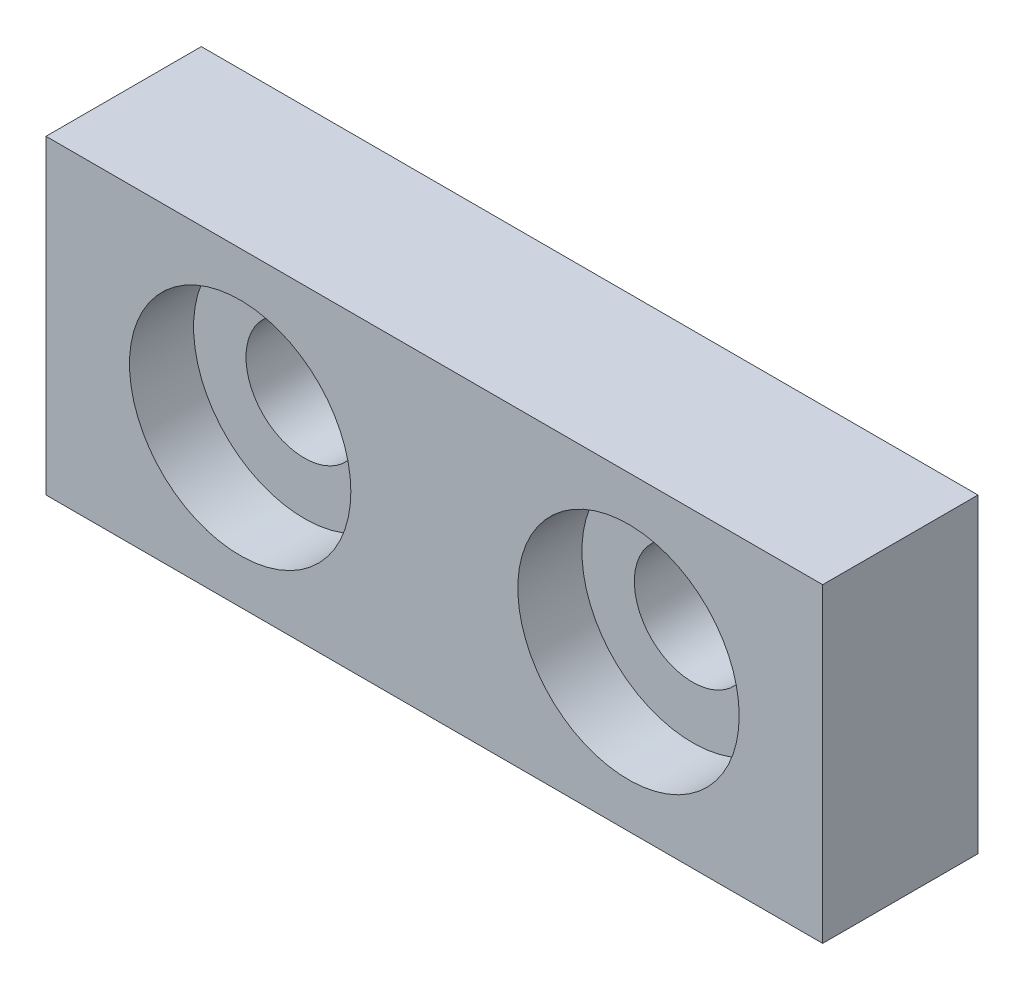
from build123d import *

# Parameters (mm, degrees)
CROQUIS1_W              = 10
CROQUIS1_H              = 8
CROQUIS1_R              = 1.5
SALIENTE_EXTRUIR1_DEPTH = 4
CROQUIS2_R              = 2.85
CORTAR_EXTRUIR1_DEPTH   = 1.65


with BuildPart() as part:
    # Croquis1 → Saliente-Extruir1 (new body)
    # profile 1 of 2: a face of its own
    with BuildSketch(Plane.XY):
        with Locations((-39.5, 69)):
            Rectangle(CROQUIS1_W, CROQUIS1_H)
        with Locations((-39.5, 69)):
            Circle(CROQUIS1_R, mode=Mode.SUBTRACT)
    # profile 2 of 2: a face of its own
    with BuildSketch(Plane.XY):
        with Locations((-49.5, 69)):
            Rectangle(CROQUIS1_W, CROQUIS1_H)
        with Locations((-49.5, 69)):
            Circle(CROQUIS1_R, mode=Mode.SUBTRACT)
    extrude(amount=SALIENTE_EXTRUIR1_DEPTH)

    # Croquis2 → Cortar-Extruir1 (cut)
    with BuildSketch(Plane.XY.offset(4)):
        with Locations((-49.5, 69)):
            Circle(CROQUIS2_R)
        with Locations((-39.5, 69)):
            Circle(CROQUIS2_R)
    extrude(amount=-CORTAR_EXTRUIR1_DEPTH, mode=Mode.SUBTRACT)


solid = part.part
